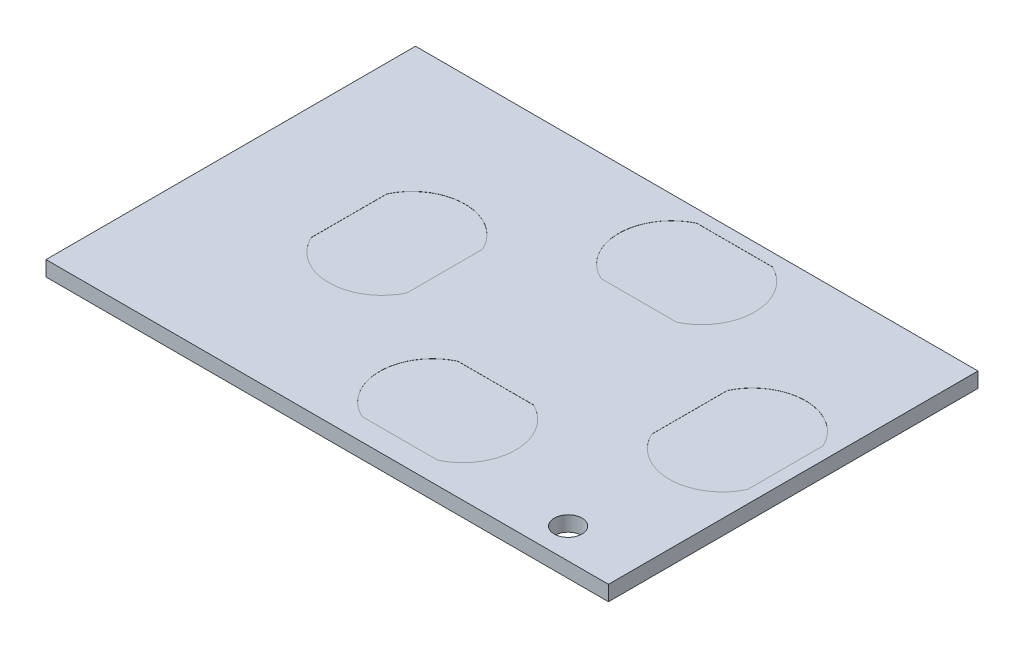
from build123d import *

# Parameters (mm, degrees)
ESQUISSE1_W             = 44.6
ESQUISSE1_H             = 29.3
ESQUISSE1_R             = 1.1
BOSS_EXTRU_2_DEPTH      = 1.2
ENL_V_MAT_EXTRU_1_DEPTH = 0.01


with BuildPart() as part:
    # Esquisse1 → Boss.-Extru.2 (new body)
    with BuildSketch(Plane(origin=(0, 0, 0), x_dir=(1, 0, 0), z_dir=(0, 1, 0))):
        Rectangle(ESQUISSE1_W, ESQUISSE1_H)
        with Locations(Location((16.7, -12.25, 0), (0, 0, 270))):
            Circle(ESQUISSE1_R, mode=Mode.SUBTRACT)
    extrude(amount=BOSS_EXTRU_2_DEPTH)

    # Esquisse7 → Enlèv. mat.-Extru.1 (cut)
    with BuildSketch(Plane(origin=(0, 1.2, 0), x_dir=(1, 0, 0), z_dir=(0, 1, 0))):
        with BuildLine():
            Line((1, 13.65), (7, 13.65))
            ThreePointArc((7, 13.65), (9.4, 9.85), (7, 6.05))
            Line((7, 6.05), (1, 6.05))
            ThreePointArc((1, 6.05), (-1.4, 9.85), (1, 13.65))
        make_face()
        with BuildLine():
            Line((1, -5.3), (7, -5.3))
            ThreePointArc((7, -5.3), (9.4, -9.1), (7, -12.9))
            Line((7, -12.9), (1, -12.9))
            ThreePointArc((1, -12.9), (-1.4, -9.1), (1, -5.3))
        make_face()
        with BuildLine():
            Line((-13.3, 3.375), (-13.3, -2.625))
            ThreePointArc((-13.3, -2.625), (-9.5, -5.025), (-5.7, -2.625))
            Line((-5.7, -2.625), (-5.7, 3.375))
            ThreePointArc((-5.7, 3.375), (-9.5, 5.775), (-13.3, 3.375))
        make_face()
        with BuildLine():
            Line((13.7, 3.375), (13.7, -2.625))
            ThreePointArc((13.7, -2.625), (17.5, -5.025), (21.3, -2.625))
            Line((21.3, -2.625), (21.3, 3.375))
            ThreePointArc((21.3, 3.375), (17.5, 5.775), (13.7, 3.375))
        make_face()
    extrude(amount=-ENL_V_MAT_EXTRU_1_DEPTH, mode=Mode.SUBTRACT)


solid = part.part
